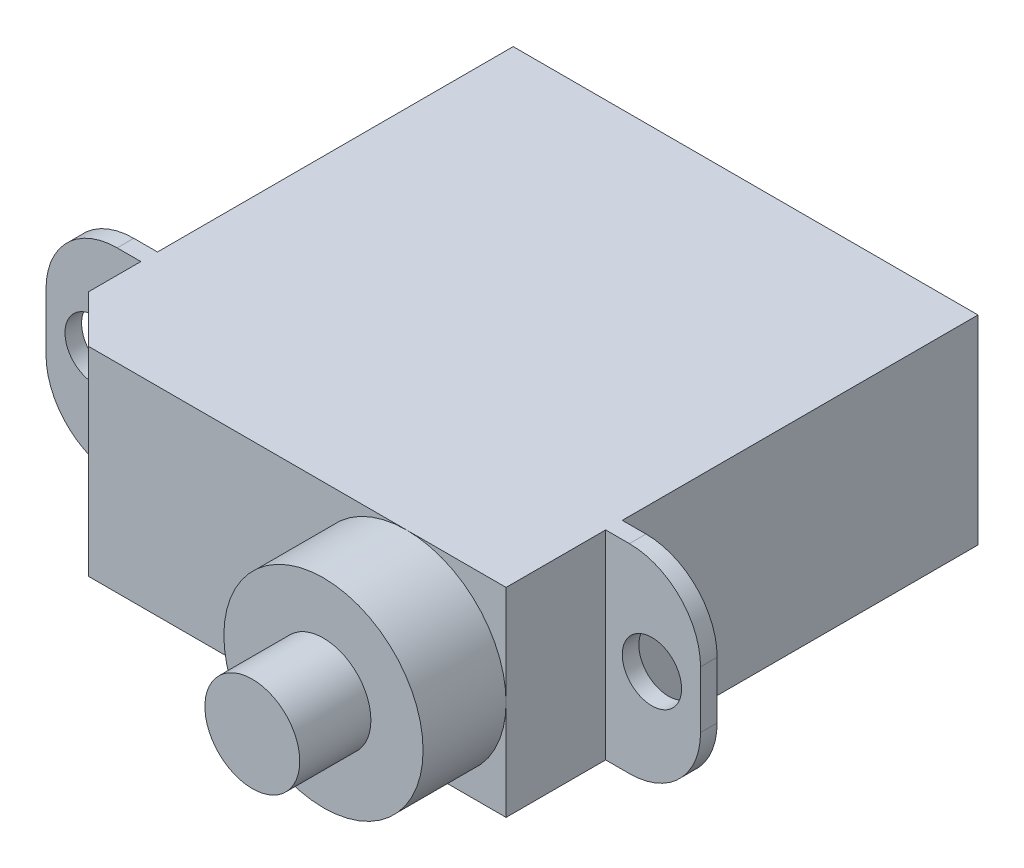
from build123d import *

# Parameters (mm, degrees)
SKETCH_1_W          = 19.6
SKETCH_1_H          = 8.4
EXTRUDE_1_DEPTH     = 19.9
CHAMFER_1_SIZE      = 2
SKETCH_2_W          = 27.6
SKETCH_2_H          = 0.7
EXTRUDE_2_DEPTH     = 8.4
FILLET_1_R          = 3
CUT_EXTRUDE_1_REACH = 23.321
SKETCH_3_R          = 1.25
SKETCH_4_R          = 4.2
EXTRUDE_3_DEPTH     = 3.5
SKETCH_5_R          = 2
EXTRUDE_4_DEPTH     = 3


with BuildPart() as part:
    # 草圖1 → 填料-伸長1 (new body)
    with BuildSketch(Plane.XY):
        Rectangle(SKETCH_1_W, SKETCH_1_H)
    extrude(amount=EXTRUDE_1_DEPTH)

    # 導角1
    chamfer_1_edges = [part.edges().sort_by_distance(p)[0] for p in [
        (-9.8, 0, 19.9),
    ]]
    chamfer(chamfer_1_edges, length=CHAMFER_1_SIZE)

    # 草圖2 → 填料-伸長2 (add)
    with BuildSketch(Plane.XZ.offset(4.2)):
        with Locations((0, 15.35)):
            Rectangle(SKETCH_2_W, SKETCH_2_H)
    extrude(amount=-EXTRUDE_2_DEPTH)

    # 圓角1
    fillet_1_edges = [part.edges().sort_by_distance(p)[0] for p in [
        (13.8, -4.2, 15.35),
        (-13.8, -4.2, 15.35),
        (13.8, 4.2, 15.35),
        (-13.8, 4.2, 15.35),
    ]]
    fillet(fillet_1_edges, radius=FILLET_1_R)

    # 草圖3 → 除料-伸長1 (cut, up to next)
    with BuildSketch(Plane.XY.offset(15.7), mode=Mode.PRIVATE) as cut_extrude_1_sk1:
        with Locations((-11.75, 0)):
            Circle(SKETCH_3_R)
    cut_extrude_1_tool1 = extrude(cut_extrude_1_sk1.sketch, amount=-CUT_EXTRUDE_1_REACH, mode=Mode.PRIVATE) & part.part
    # 草圖3 → 除料-伸長1 (cut, up to next)
    with BuildSketch(Plane.XY.offset(15.7), mode=Mode.PRIVATE) as cut_extrude_1_sk2:
        with Locations((11.75, 0)):
            Circle(SKETCH_3_R)
    cut_extrude_1_tool2 = extrude(cut_extrude_1_sk2.sketch, amount=-CUT_EXTRUDE_1_REACH, mode=Mode.PRIVATE) & part.part
    add(cut_extrude_1_tool1.solids().sort_by_distance((-11.75, 0, 15.7))[0], mode=Mode.SUBTRACT)
    add(cut_extrude_1_tool2.solids().sort_by_distance((11.75, 0, 15.7))[0], mode=Mode.SUBTRACT)

    # 草圖4 → 填料-伸長3 (add)
    with BuildSketch(Plane.XY.offset(19.9)):
        with Locations((5.6, 0)):
            Circle(SKETCH_4_R)
    extrude(amount=EXTRUDE_3_DEPTH)

    # 草圖5 → 填料-伸長4 (add)
    with BuildSketch(Plane.XY.offset(23.4)):
        with Locations((5.6, 0)):
            Circle(SKETCH_5_R)
    extrude(amount=EXTRUDE_4_DEPTH)


solid = part.part
